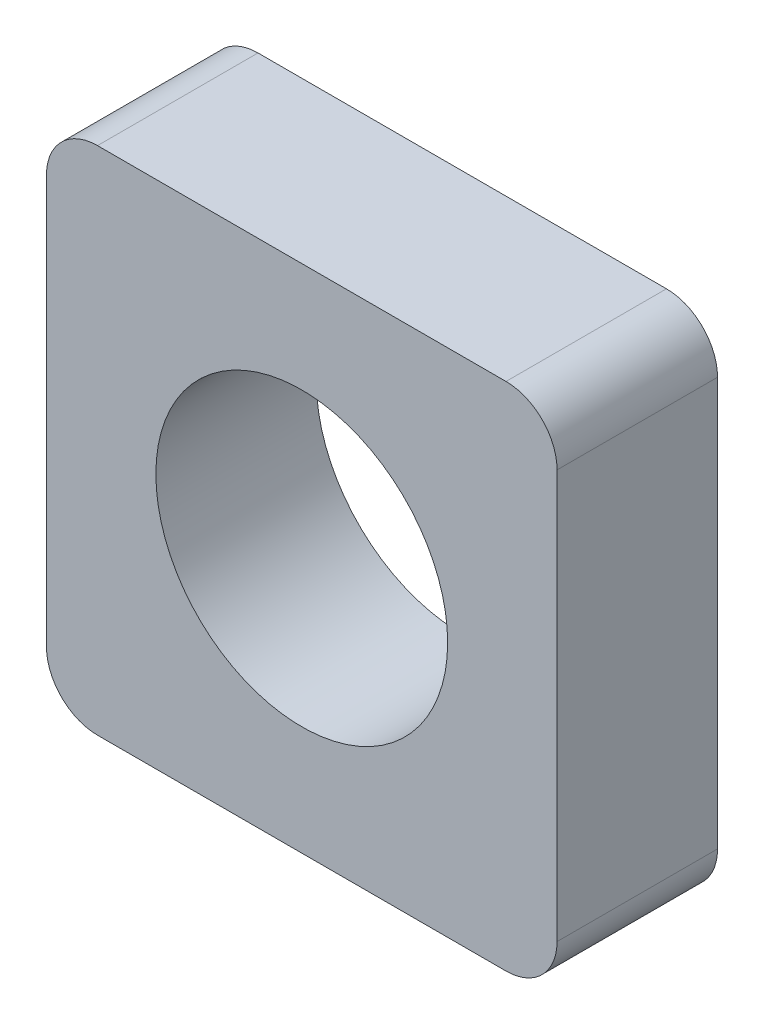
from build123d import *

# Parameters (mm, degrees)
SKETCH1_W           = 7
SKETCH1_H           = 7
SKETCH1_R           = 2
BOSS_EXTRUDE1_DEPTH = 2.2
FILLET1_R           = 0.7


with BuildPart() as part:
    # Sketch1 → Boss-Extrude1 (new body)
    with BuildSketch(Plane.XY):
        Rectangle(SKETCH1_W, SKETCH1_H)
        Circle(SKETCH1_R, mode=Mode.SUBTRACT)
    extrude(amount=BOSS_EXTRUDE1_DEPTH)

    # Fillet1
    fillet1_edges = [part.edges().sort_by_distance(p)[0] for p in [
        (3.5, -3.5, 1.1),
        (-3.5, -3.5, 1.1),
        (-3.5, 3.5, 1.1),
        (3.5, 3.5, 1.1),
    ]]
    fillet(fillet1_edges, radius=FILLET1_R)


solid = part.part
